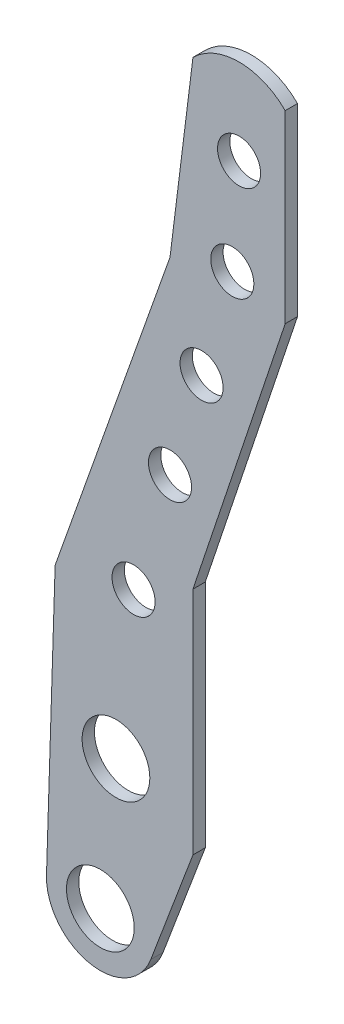
from build123d import *

# Parameters (mm, degrees)
SKETCH2_R           = 11
SKETCH2_R_2         = 7
BOSS_EXTRUDE1_DEPTH = 4


with BuildPart() as part:
    # Sketch2 → Boss-Extrude1 (new body)
    with BuildSketch(Plane.XY):
        with BuildLine():
            Line((30.078103468, 30.102899094), (30.078103468, 104.858637586))
            Line((30.078103468, 104.858637586), (43.656234688, 145.478166756))
            Line((43.656234688, 145.478166756), (60.038536544, 194.486485935))
            Line((60.038536544, 194.486485935), (60.038536544, 254.427096014))
            ThreePointArc((60.038536544, 254.427096014), (45.05832001, 260.632104877), (30.078103469, 254.427096029))
            Line((30.078103469, 254.427096029), (22.62926434, 194.486485916))
            Line((22.62926434, 194.486485916), (-14.683335653, 89.230795609))
            Line((-14.683335653, 89.230795609), (-17.49123357, 0.553848547))
            ThreePointArc((-17.49123357, 0.553848547), (-3.415184823, -17.163522734), (16.370945819, -6.184022397))
            Line((16.370945819, -6.184022397), (30.078103468, 30.102899094))
        make_face()
        Circle(SKETCH2_R, mode=Mode.SUBTRACT)
        with Locations((45.058319997, 232.788133995)):
            Circle(SKETCH2_R_2, mode=Mode.SUBTRACT)
        with Locations((42.85515341, 200.574247039)):
            Circle(SKETCH2_R_2, mode=Mode.SUBTRACT)
        with Locations((32.877400798, 166.36480954)):
            Circle(SKETCH2_R_2, mode=Mode.SUBTRACT)
        with Locations((22.629264347, 133.284451418)):
            Circle(SKETCH2_R_2, mode=Mode.SUBTRACT)
        with Locations((10.792452444, 95.075946031)):
            Circle(SKETCH2_R_2, mode=Mode.SUBTRACT)
        with Locations((5.075535148, 44.712849864)):
            Circle(SKETCH2_R, mode=Mode.SUBTRACT)
    extrude(amount=BOSS_EXTRUDE1_DEPTH)


solid = part.part
